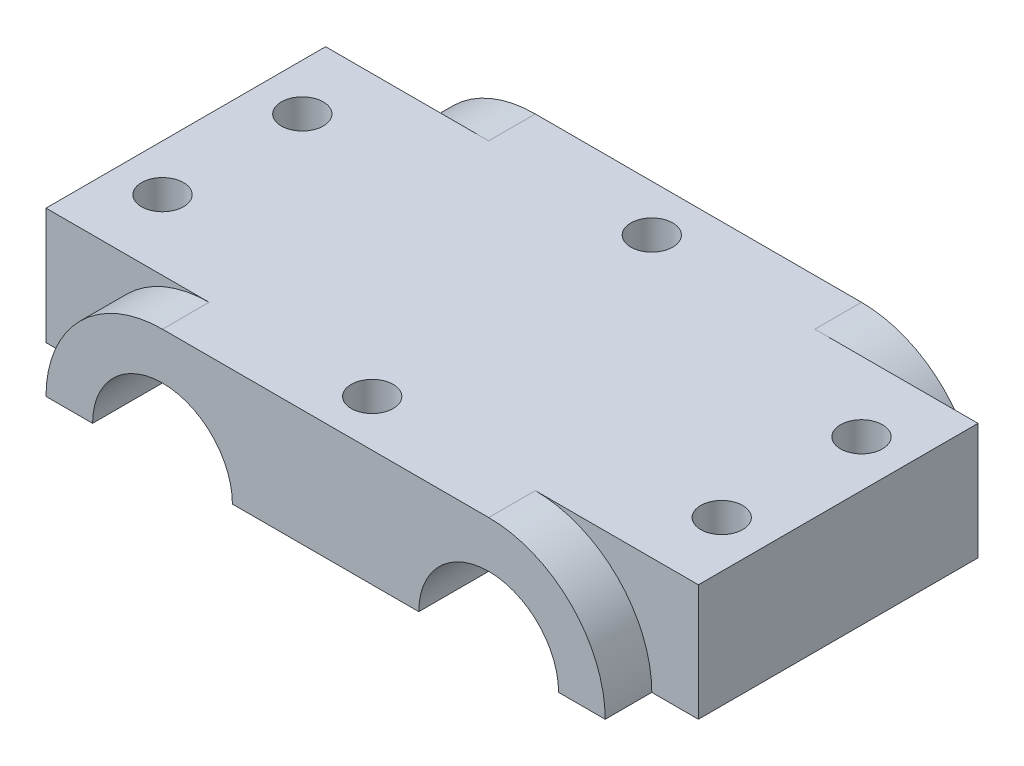
from build123d import *

# Parameters (mm, degrees)
SKETCH2_W                = 70
SKETCH2_H                = 30
BOSS_EXTRUDE1_DEPTH      = 12.5
BOSS_EXTRUDE2_DEPTH      = 5
BOSS_EXTRUDE2_DEPTH_BACK = 35
CUT_EXTRUDE1_DEPTH       = 52.051444642
SKETCH5_R                = 2.25
CUT_EXTRUDE2_DEPTH       = 43.20485754


with BuildPart() as part:
    # Sketch2 → Boss-Extrude1 (new body)
    with BuildSketch(Plane(origin=(0, 0, 0), x_dir=(1, 0, 0), z_dir=(0, 1, 0))):
        Rectangle(SKETCH2_W, SKETCH2_H)
    extrude(amount=BOSS_EXTRUDE1_DEPTH)

    # Sketch3 → Boss-Extrude2 (add, two sides: drawn at the far end of the back side and taken through both)
    with BuildSketch(Plane.XY.offset(15).offset(-BOSS_EXTRUDE2_DEPTH_BACK)):
        with BuildLine():
            Line((17.5, 12.5), (-17.5, 12.5))
            ThreePointArc((-17.5, 12.5), (-26.338834765, 8.838834765), (-30, 0))
            Line((-30, 0), (-25, 0))
            ThreePointArc((-25, 0), (-17.5, 7.5), (-10, 0))
            Line((-10, 0), (10, 0))
            ThreePointArc((10, 0), (17.5, 7.5), (25, 0))
            Line((25, 0), (30, 0))
            ThreePointArc((30, 0), (26.338834765, 8.838834765), (17.5, 12.5))
        make_face()
    extrude(amount=BOSS_EXTRUDE2_DEPTH + BOSS_EXTRUDE2_DEPTH_BACK)

    # Sketch4 → Cut-Extrude1 (cut, through all)
    with BuildSketch(Plane.XY.offset(15)):
        with BuildLine():
            Line((-25, 0), (-10, 0))
            ThreePointArc((-10, 0), (-17.5, 7.5), (-25, 0))
        make_face()
        with BuildLine():
            Line((10, 0), (25, 0))
            ThreePointArc((25, 0), (17.5, 7.5), (10, 0))
        make_face()
    extrude(amount=-CUT_EXTRUDE1_DEPTH, mode=Mode.SUBTRACT)

    # Sketch5 → Cut-Extrude2 (cut, through all)
    with BuildSketch(Plane(origin=(0, 12.5, 0), x_dir=(1, 0, 0), z_dir=(0, 1, 0))):
        with Locations(Location((0, -15, 0), (0, 0, 270))):
            Circle(SKETCH5_R)
        with Locations(Location((-30, -7.5, 0), (0, 0, 270))):
            Circle(SKETCH5_R)
        with Locations(Location((30, -7.5, 0), (0, 0, 90))):
            Circle(SKETCH5_R)
        with Locations(Location((30, 7.5, 0), (0, 0, 270))):
            Circle(SKETCH5_R)
        with Locations(Location((-30, 7.5, 0), (0, 0, 90))):
            Circle(SKETCH5_R)
        with Locations(Location((0, 15, 0), (0, 0, 90))):
            Circle(SKETCH5_R)
    extrude(amount=-CUT_EXTRUDE2_DEPTH, mode=Mode.SUBTRACT)


solid = part.part
